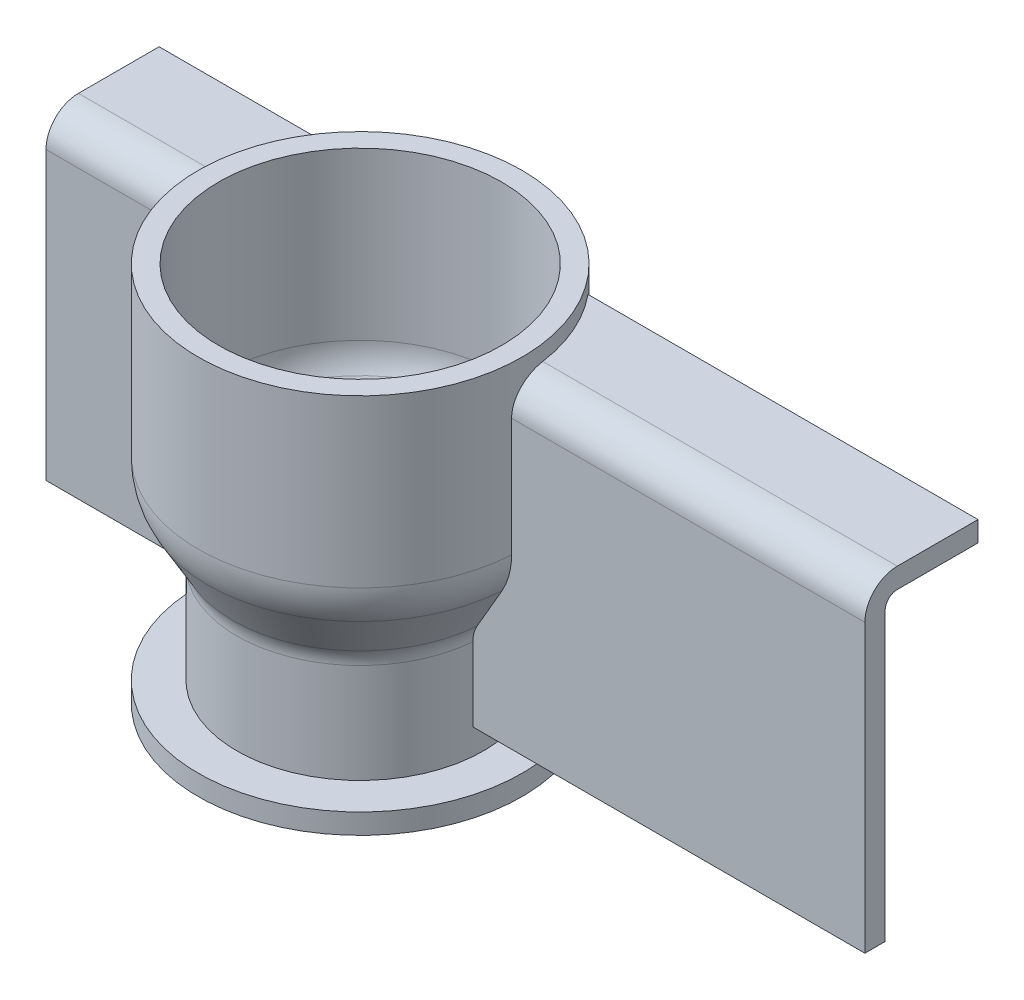
from build123d import *

# Parameters (mm, degrees)
EXTRUDE_THIN1_REACH = 195.29
SKETCH2_R           = 39.925
BOSS_EXTRUDE1_DEPTH = 5
BOSS_EXTRUDE2_REACH = 228.308


with BuildPart() as part:
    # strainer → Revolve-Thin1 (revolve)
    with BuildSketch(Plane.XY, mode=Mode.PRIVATE) as revolve_thin1_sk:
        with BuildLine():
            Line((-34.925, 0), (-34.925, -41.047045184))
            ThreePointArc((-34.925, -41.047045184), (-34.492257994, -44.334047057), (-33.223522628, -47.397045184))
            Line((-33.223522628, -47.397045184), (-27.101477372, -58.000738614))
            ThreePointArc((-27.101477372, -58.000738614), (-25.832742006, -61.063736741), (-25.4, -64.350738614))
            Line((-25.4, -64.350738614), (-25.4, -88.9))
            Line((-25.4, -88.9), (-30.4, -88.9))
            Line((-30.4, -88.9), (-30.4, -64.350738614))
            ThreePointArc((-30.4, -64.350738614), (-30.662371138, -62.357831967), (-31.431604391, -60.500738614))
            Line((-31.431604391, -60.500738614), (-37.553649647, -49.897045184))
            ThreePointArc((-37.553649647, -49.897045184), (-39.321887125, -45.628142282), (-39.925, -41.047045184))
            Line((-39.925, -41.047045184), (-39.925, 0))
            Line((-39.925, 0), (-34.925, 0))
        make_face()
    revolve(revolve_thin1_sk.sketch.rotate(Axis((0, 0, 0), (0, 1, 0)), 270), axis=Axis((0, 0, 0), (0, 1, 0)))

    # bracket → Extrude-Thin1 (add, up to next)
    with BuildSketch(Plane(origin=(127, 0, 0), x_dir=(0, 0, -1), z_dir=(1, 0, 0)), mode=Mode.PRIVATE) as extrude_thin1_sk1:
        with BuildLine():
            Line((25.4, -3.85), (5.5, -3.85))
            ThreePointArc((5.5, -3.85), (-0.156854249, -6.193145751), (-2.5, -11.85))
            Line((-2.5, -11.85), (-2.5, -82.55))
            Line((-2.5, -82.55), (2.5, -82.55))
            Line((2.5, -82.55), (2.5, -11.85))
            ThreePointArc((2.5, -11.85), (3.378679656, -9.728679656), (5.5, -8.85))
            Line((5.5, -8.85), (25.4, -8.85))
            Line((25.4, -8.85), (25.4, -3.85))
        make_face()
    extrude_thin1_tool1 = extrude(extrude_thin1_sk1.sketch, amount=-EXTRUDE_THIN1_REACH, mode=Mode.PRIVATE) - part.part
    add(extrude_thin1_tool1.solids().sort_by_distance((127, -4.684991, -15.45))[0])

    # Sketch2 → Boss-Extrude1 (add)
    with BuildSketch(Plane.XZ.offset(88.9)):
        with Locations(Location((0, 0, 0), (0, 0, 270))):
            Circle(SKETCH2_R)
    extrude(amount=BOSS_EXTRUDE1_DEPTH)

    # Sketch4 → Boss-Extrude2 (add, up to next)
    with BuildSketch(Plane(origin=(-75, 0, 0), x_dir=(0, 0, -1), z_dir=(1, 0, 0)), mode=Mode.PRIVATE) as boss_extrude2_sk1:
        with BuildLine():
            Line((5.5, -8.85), (25.4, -8.85))
            Line((25.4, -8.85), (25.4, -3.85))
            Line((25.4, -3.85), (5.5, -3.85))
            ThreePointArc((5.5, -3.85), (-0.156854249, -6.193145751), (-2.5, -11.85))
            Line((-2.5, -11.85), (-2.5, -82.55))
            Line((-2.5, -82.55), (2.5, -82.55))
            Line((2.5, -82.55), (2.5, -11.85))
            ThreePointArc((2.5, -11.85), (3.378679656, -9.728679656), (5.5, -8.85))
        make_face()
    boss_extrude2_tool1 = extrude(boss_extrude2_sk1.sketch, amount=BOSS_EXTRUDE2_REACH, mode=Mode.PRIVATE) - part.part
    add(boss_extrude2_tool1.solids().sort_by_distance((-75, -9.138252, -2.788252))[0])


solid = part.part
